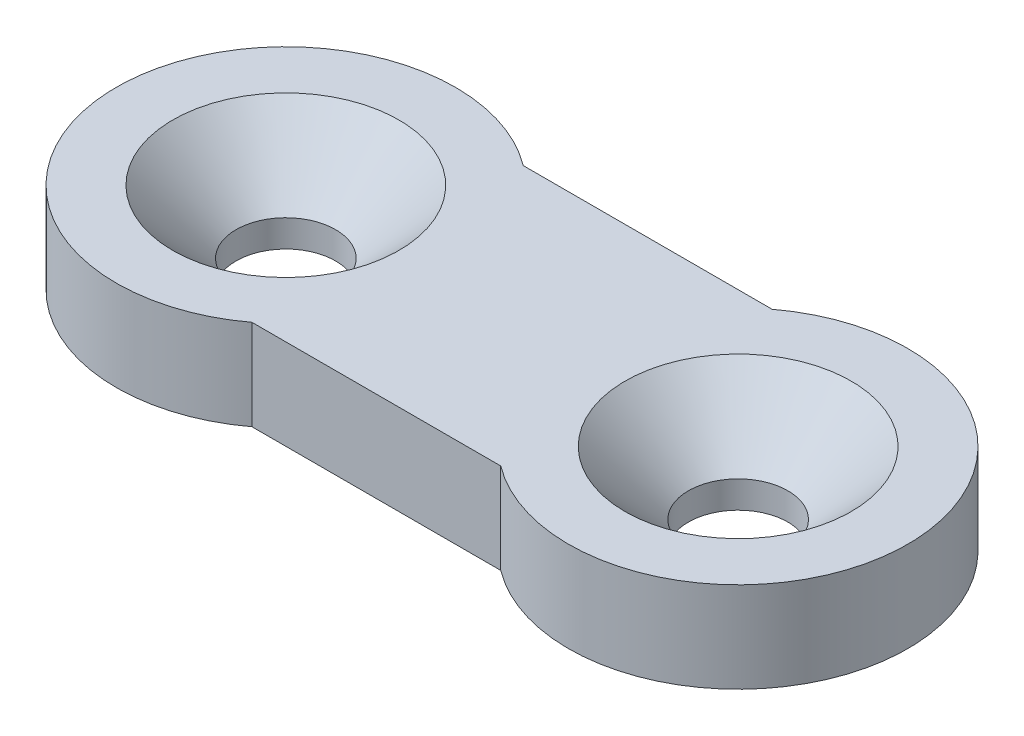
from build123d import *

# Parameters (mm, degrees)
SKETCH1_R           = 1.1
BOSS_EXTRUDE1_DEPTH = 2
BOSS_EXTRUDE3_START = -2
SKETCH3_R           = 3.75
SKETCH3_R_2         = 1.1
BOSS_EXTRUDE3_DEPTH = 2
CHAMFER1_SIZE       = 1.4


with BuildPart() as part:
    # Sketch1 → Boss-Extrude1 (new body)
    with BuildSketch(Plane(origin=(0, 0, 0), x_dir=(1, 0, 0), z_dir=(0, 1, 0))):
        with BuildLine():
            Line((-5, 3), (5, 3))
            ThreePointArc((5, 3), (8, 0), (5, -3))
            Line((5, -3), (-5, -3))
            ThreePointArc((-5, -3), (-8, 0), (-5, 3))
        make_face()
        with Locations(Location((-5, 0, 0), (0, 0, 270))):
            Circle(SKETCH1_R, mode=Mode.SUBTRACT)
        with Locations(Location((5, 0, 0), (0, 0, 270))):
            Circle(SKETCH1_R, mode=Mode.SUBTRACT)
    extrude(amount=BOSS_EXTRUDE1_DEPTH)

    # Sketch3 → Boss-Extrude3 (add)
    # profile 1 of 2: a face of its own
    with BuildSketch(Plane(origin=(0, 2, 0), x_dir=(1, 0, 0), z_dir=(0, 1, 0)).offset(BOSS_EXTRUDE3_START)):
        with Locations((-5, 0)):
            Circle(SKETCH3_R)
        with Locations(Location((-5, 0, 0), (0, 0, 270))):
            Circle(SKETCH3_R_2, mode=Mode.SUBTRACT)
    # profile 2 of 2: a face of its own
    with BuildSketch(Plane(origin=(0, 2, 0), x_dir=(1, 0, 0), z_dir=(0, 1, 0)).offset(BOSS_EXTRUDE3_START)):
        with Locations((5, 0)):
            Circle(SKETCH3_R)
        with Locations(Location((5, 0, 0), (0, 0, 270))):
            Circle(SKETCH3_R_2, mode=Mode.SUBTRACT)
    extrude(amount=BOSS_EXTRUDE3_DEPTH)

    # Chamfer1
    chamfer1_edges = [part.edges().sort_by_distance(p)[0] for p in [
        (-5, 2, -1.1),
        (5, 2, -1.1),
    ]]
    chamfer(chamfer1_edges, length=CHAMFER1_SIZE)


solid = part.part
